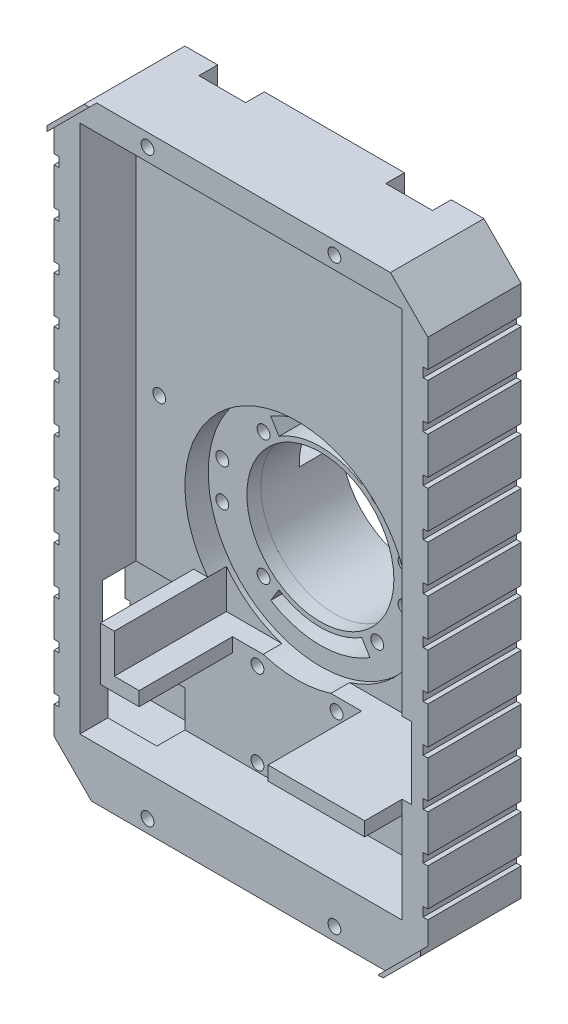
from build123d import *

# Parameters (mm, degrees)
SKETCH1_W               = 101.6
SKETCH1_H               = 165.1
BOSS_EXTRUDE1_DEPTH     = 25.4
SKETCH2_W               = 87.60000006
SKETCH2_H               = 143.87600003
CUT_EXTRUDE1_DEPTH      = 15.24
SKETCH3_R               = 19.9874886
CUT_EXTRUDE2_DEPTH      = 99.119315632
SKETCH4_R               = 26.9875
SKETCH4_R_2             = 19.98750003
BOSS_EXTRUDE2_DEPTH     = 21.844
CUT_EXTRUDE3_DEPTH      = 108.44267553
CUT_EXTRUDE3_DEPTH_BACK = 108.44267553
SKETCH6_R               = 1.750000056
SKETCH7_R               = 1.750000056
CUT_EXTRUDE4_DEPTH      = 108.829207713
SKETCH8_W               = 12.7
SKETCH8_H               = 7.000000224
SKETCH8_H_2             = 6.999986
CUT_EXTRUDE5_DEPTH      = 5.08
SKETCH9_W               = 13.6525
SKETCH9_H               = 25.4
CUT_EXTRUDE6_DEPTH      = 101.201309872
SKETCH10_W              = 11.43
SKETCH10_H              = 11.43
CUT_EXTRUDE7_DEPTH      = 101.201309872
SKETCH11_R              = 30.48
CUT_EXTRUDE8_DEPTH      = 6.35
CUT_EXTRUDE9_REACH      = 109.829
CUT_EXTRUDE10_REACH     = 102.201
SKETCH13_W              = 2.54
SKETCH13_H              = 2.54
CHAMFER9_SIZE           = 10.16
SKETCH14_R              = 1.75
SKETCH14_R_2            = 1.750000056
CUT_EXTRUDE11_DEPTH     = 2.54
SKETCH15_R              = 1.75
CUT_EXTRUDE12_DEPTH     = 5.08
BOSS_EXTRUDE3_DEPTH     = 2
SKETCH18_W              = 13.208
SKETCH18_H              = 18.5
SKETCH18_W_2            = 10.16
SKETCH18_H_2            = 10.16
CUT_EXTRUDE14_DEPTH     = 20.32
SKETCH19_R              = 1.75
CUT_EXTRUDE15_DEPTH     = 5.08
SKETCH20_W              = 6.35
SKETCH20_H              = 13.97
CUT_EXTRUDE16_DEPTH     = 21.59
SKETCH21_W              = 68.072
SKETCH21_H              = 19.558
CUT_EXTRUDE17_DEPTH     = 5.08
SKETCH22_W              = 26.275709958
SKETCH22_H              = 3.81
BOSS_EXTRUDE4_DEPTH     = 25.4
SKETCH23_W              = 20.32
SKETCH23_H              = 19.558
CUT_EXTRUDE18_DEPTH     = 2.54
CUT_EXTRUDE19_DEPTH     = 102.996102867


with BuildPart() as part:
    # Sketch1 → Boss-Extrude1 (new body)
    with BuildSketch(Plane.XY):
        Rectangle(SKETCH1_W, SKETCH1_H)
    extrude(amount=BOSS_EXTRUDE1_DEPTH)

    # Sketch2 → Cut-Extrude1 (cut)
    with BuildSketch(Plane.XY.offset(25.4)):
        with Locations((0, 3.612000015)):
            Rectangle(SKETCH2_W, SKETCH2_H)
    extrude(amount=-CUT_EXTRUDE1_DEPTH, mode=Mode.SUBTRACT)

    # Sketch3 → Cut-Extrude2 (cut, through all)
    with BuildSketch(Plane.XY.offset(10.16)):
        with Locations((0, -10.818398691)):
            Circle(SKETCH3_R)
    extrude(amount=-CUT_EXTRUDE2_DEPTH, mode=Mode.SUBTRACT)

    # Sketch4 → Boss-Extrude2 (add)
    with BuildSketch(Plane(origin=(0, 0, 0), x_dir=(-1, 0, 0), z_dir=(0, 0, -1))):
        with Locations((0, -10.818398691)):
            Circle(SKETCH4_R)
        with Locations(Location((0, -10.818398691, 0), (0, 0, 180))):
            Circle(SKETCH4_R_2, mode=Mode.SUBTRACT)
    extrude(amount=BOSS_EXTRUDE2_DEPTH)

    # Sketch6 → Cut-Extrude3 (cut, two sides: drawn at the far end of the back side and taken through both)
    with BuildSketch(Plane(origin=(0, 0, -20.955), x_dir=(-1, 0, 0), z_dir=(0, 0, -1)).offset(-CUT_EXTRUDE3_DEPTH_BACK)):
        with Locations((15.45282644, 6.199601309)):
            Circle(SKETCH6_R)
        with Locations((15.45282644, -27.836398691)):
            Circle(SKETCH6_R)
        with Locations((-15.45282644, 6.199601309)):
            Circle(SKETCH6_R)
        with Locations((-15.45282644, -27.836398691)):
            Circle(SKETCH6_R)
    extrude(amount=CUT_EXTRUDE3_DEPTH + CUT_EXTRUDE3_DEPTH_BACK, mode=Mode.SUBTRACT)

    # Sketch7 → Cut-Extrude4 (cut, through all)
    with BuildSketch(Plane.XY.offset(25.4)):
        with Locations((-25.4, 79.049999888)):
            Circle(SKETCH7_R)
        with Locations((25.4, -79.049999888)):
            Circle(SKETCH7_R)
        with Locations((-25.4, -79.049999888)):
            Circle(SKETCH7_R)
        with Locations((25.4, 79.049999888)):
            Circle(SKETCH7_R)
    extrude(amount=-CUT_EXTRUDE4_DEPTH, mode=Mode.SUBTRACT)

    # Sketch8 → Cut-Extrude5 (cut)
    with BuildSketch(Plane(origin=(0, 0, 0), x_dir=(-1, 0, 0), z_dir=(0, 0, -1))):
        with Locations((25.4, 79.049999888)):
            Rectangle(SKETCH8_W, SKETCH8_H)
        with Locations((-25.4, 79.050007)):
            Rectangle(SKETCH8_W, SKETCH8_H_2)
        with Locations((25.4, -79.050007)):
            Rectangle(SKETCH8_W, SKETCH8_H_2)
        with Locations((-25.4, -79.049999888)):
            Rectangle(SKETCH8_W, SKETCH8_H)
    extrude(amount=-CUT_EXTRUDE5_DEPTH, mode=Mode.SUBTRACT)

    # Sketch9 → Cut-Extrude6 (cut, through all)
    with BuildSketch(Plane(origin=(0, 0, 0), x_dir=(0, 0, -1), z_dir=(1, 0, 0))):
        with Locations((15.01775, -10.818398691)):
            Rectangle(SKETCH9_W, SKETCH9_H)
    extrude(amount=CUT_EXTRUDE6_DEPTH, mode=Mode.SUBTRACT)

    # Sketch10 → Cut-Extrude7 (cut, through all)
    with BuildSketch(Plane(origin=(0, 0, 0), x_dir=(0, 0, -1), z_dir=(1, 0, 0))):
        with Locations((16.129, -5.738398691)):
            Rectangle(SKETCH10_W, SKETCH10_H)
    extrude(amount=-CUT_EXTRUDE7_DEPTH, mode=Mode.SUBTRACT)

    # Sketch11 → Cut-Extrude8 (cut)
    with BuildSketch(Plane.XY.offset(10.16)):
        with Locations((0, -10.818398691)):
            Circle(SKETCH11_R)
    extrude(amount=-CUT_EXTRUDE8_DEPTH, mode=Mode.SUBTRACT)

    # Sketch12 → Cut-Extrude9 (cut, up to next)
    with BuildSketch(Plane(origin=(0, 0, -21.844), x_dir=(-1, 0, 0), z_dir=(0, 0, -1)), mode=Mode.PRIVATE) as cut_extrude9_sk1:
        with BuildLine():
            Line((-13.4967946, 10.853237604), (-11.250156679, 7.24583886))
            ThreePointArc((-11.250156679, 7.24583886), (-1.4e-08, 10.462642251), (11.250156655, 7.245838875))
            Line((11.250156655, 7.245838875), (13.49679457, 10.853237623))
            ThreePointArc((13.49679457, 10.853237623), (-1.7e-08, 14.712431381), (-13.4967946, 10.853237604))
        make_face()
    cut_extrude9_tool1 = extrude(cut_extrude9_sk1.sketch, amount=-CUT_EXTRUDE9_REACH, mode=Mode.PRIVATE) & part.part
    # Sketch12 → Cut-Extrude9 (cut, up to next)
    with BuildSketch(Plane(origin=(0, 0, -21.844), x_dir=(-1, 0, 0), z_dir=(0, 0, -1)), mode=Mode.PRIVATE) as cut_extrude9_sk2:
        with BuildLine():
            Line((-13.4967946, -32.490034986), (-11.250156679, -28.882636241))
            ThreePointArc((-11.250156679, -28.882636241), (-1.4e-08, -32.099439633), (11.250156655, -28.882636256))
            Line((11.250156655, -28.882636256), (13.49679457, -32.490035004))
            ThreePointArc((13.49679457, -32.490035004), (-1.7e-08, -36.349228763), (-13.4967946, -32.490034986))
        make_face()
    cut_extrude9_tool2 = extrude(cut_extrude9_sk2.sketch, amount=-CUT_EXTRUDE9_REACH, mode=Mode.PRIVATE) & part.part
    add(cut_extrude9_tool1.solids().sort_by_distance((0, 11.4569, -21.844))[0], mode=Mode.SUBTRACT)
    add(cut_extrude9_tool2.solids().sort_by_distance((0, -33.093697, -21.844))[0], mode=Mode.SUBTRACT)

    # Sketch13 → Cut-Extrude10 (cut, up to next)
    with BuildSketch(Plane(origin=(0, 0, 0), x_dir=(-1, 0, 0), z_dir=(0, 0, -1)), mode=Mode.PRIVATE) as cut_extrude10_sk1:
        with Locations((-50.8, -63.5)):
            Rectangle(SKETCH13_W, SKETCH13_H)
    cut_extrude10_tool1 = extrude(cut_extrude10_sk1.sketch, amount=-CUT_EXTRUDE10_REACH, mode=Mode.PRIVATE) & part.part
    # Sketch13 → Cut-Extrude10 (cut, up to next)
    with BuildSketch(Plane(origin=(0, 0, 0), x_dir=(-1, 0, 0), z_dir=(0, 0, -1)), mode=Mode.PRIVATE) as cut_extrude10_sk2:
        with Locations((-50.8, -50.8)):
            Rectangle(SKETCH13_W, SKETCH13_H)
    cut_extrude10_tool2 = extrude(cut_extrude10_sk2.sketch, amount=-CUT_EXTRUDE10_REACH, mode=Mode.PRIVATE) & part.part
    # Sketch13 → Cut-Extrude10 (cut, up to next)
    with BuildSketch(Plane(origin=(0, 0, 0), x_dir=(-1, 0, 0), z_dir=(0, 0, -1)), mode=Mode.PRIVATE) as cut_extrude10_sk3:
        with Locations((-50.8, -38.1)):
            Rectangle(SKETCH13_W, SKETCH13_H)
    cut_extrude10_tool3 = extrude(cut_extrude10_sk3.sketch, amount=-CUT_EXTRUDE10_REACH, mode=Mode.PRIVATE) & part.part
    # Sketch13 → Cut-Extrude10 (cut, up to next)
    with BuildSketch(Plane(origin=(0, 0, 0), x_dir=(-1, 0, 0), z_dir=(0, 0, -1)), mode=Mode.PRIVATE) as cut_extrude10_sk4:
        with Locations((-50.8, -25.4)):
            Rectangle(SKETCH13_W, SKETCH13_H)
    cut_extrude10_tool4 = extrude(cut_extrude10_sk4.sketch, amount=-CUT_EXTRUDE10_REACH, mode=Mode.PRIVATE) & part.part
    # Sketch13 → Cut-Extrude10 (cut, up to next)
    with BuildSketch(Plane(origin=(0, 0, 0), x_dir=(-1, 0, 0), z_dir=(0, 0, -1)), mode=Mode.PRIVATE) as cut_extrude10_sk5:
        with Locations((-50.8, -12.7)):
            Rectangle(SKETCH13_W, SKETCH13_H)
    cut_extrude10_tool5 = extrude(cut_extrude10_sk5.sketch, amount=-CUT_EXTRUDE10_REACH, mode=Mode.PRIVATE) & part.part
    # Sketch13 → Cut-Extrude10 (cut, up to next)
    with BuildSketch(Plane(origin=(0, 0, 0), x_dir=(-1, 0, 0), z_dir=(0, 0, -1)), mode=Mode.PRIVATE) as cut_extrude10_sk6:
        with Locations((-50.8, 0)):
            Rectangle(SKETCH13_W, SKETCH13_H)
    cut_extrude10_tool6 = extrude(cut_extrude10_sk6.sketch, amount=-CUT_EXTRUDE10_REACH, mode=Mode.PRIVATE) & part.part
    # Sketch13 → Cut-Extrude10 (cut, up to next)
    with BuildSketch(Plane(origin=(0, 0, 0), x_dir=(-1, 0, 0), z_dir=(0, 0, -1)), mode=Mode.PRIVATE) as cut_extrude10_sk7:
        with Locations((-50.8, 12.7)):
            Rectangle(SKETCH13_W, SKETCH13_H)
    cut_extrude10_tool7 = extrude(cut_extrude10_sk7.sketch, amount=-CUT_EXTRUDE10_REACH, mode=Mode.PRIVATE) & part.part
    # Sketch13 → Cut-Extrude10 (cut, up to next)
    with BuildSketch(Plane(origin=(0, 0, 0), x_dir=(-1, 0, 0), z_dir=(0, 0, -1)), mode=Mode.PRIVATE) as cut_extrude10_sk8:
        with Locations((-50.8, 25.4)):
            Rectangle(SKETCH13_W, SKETCH13_H)
    cut_extrude10_tool8 = extrude(cut_extrude10_sk8.sketch, amount=-CUT_EXTRUDE10_REACH, mode=Mode.PRIVATE) & part.part
    # Sketch13 → Cut-Extrude10 (cut, up to next)
    with BuildSketch(Plane(origin=(0, 0, 0), x_dir=(-1, 0, 0), z_dir=(0, 0, -1)), mode=Mode.PRIVATE) as cut_extrude10_sk9:
        with Locations((-50.8, 38.1)):
            Rectangle(SKETCH13_W, SKETCH13_H)
    cut_extrude10_tool9 = extrude(cut_extrude10_sk9.sketch, amount=-CUT_EXTRUDE10_REACH, mode=Mode.PRIVATE) & part.part
    # Sketch13 → Cut-Extrude10 (cut, up to next)
    with BuildSketch(Plane(origin=(0, 0, 0), x_dir=(-1, 0, 0), z_dir=(0, 0, -1)), mode=Mode.PRIVATE) as cut_extrude10_sk10:
        with Locations((-50.8, 50.8)):
            Rectangle(SKETCH13_W, SKETCH13_H)
    cut_extrude10_tool10 = extrude(cut_extrude10_sk10.sketch, amount=-CUT_EXTRUDE10_REACH, mode=Mode.PRIVATE) & part.part
    # Sketch13 → Cut-Extrude10 (cut, up to next)
    with BuildSketch(Plane(origin=(0, 0, 0), x_dir=(-1, 0, 0), z_dir=(0, 0, -1)), mode=Mode.PRIVATE) as cut_extrude10_sk11:
        with Locations((-50.8, 63.5)):
            Rectangle(SKETCH13_W, SKETCH13_H)
    cut_extrude10_tool11 = extrude(cut_extrude10_sk11.sketch, amount=-CUT_EXTRUDE10_REACH, mode=Mode.PRIVATE) & part.part
    # Sketch13 → Cut-Extrude10 (cut, up to next)
    with BuildSketch(Plane(origin=(0, 0, 0), x_dir=(-1, 0, 0), z_dir=(0, 0, -1)), mode=Mode.PRIVATE) as cut_extrude10_sk12:
        with Locations((50.8, -63.5)):
            Rectangle(SKETCH13_W, SKETCH13_H)
    cut_extrude10_tool12 = extrude(cut_extrude10_sk12.sketch, amount=-CUT_EXTRUDE10_REACH, mode=Mode.PRIVATE) & part.part
    # Sketch13 → Cut-Extrude10 (cut, up to next)
    with BuildSketch(Plane(origin=(0, 0, 0), x_dir=(-1, 0, 0), z_dir=(0, 0, -1)), mode=Mode.PRIVATE) as cut_extrude10_sk13:
        with Locations((50.8, -50.8)):
            Rectangle(SKETCH13_W, SKETCH13_H)
    cut_extrude10_tool13 = extrude(cut_extrude10_sk13.sketch, amount=-CUT_EXTRUDE10_REACH, mode=Mode.PRIVATE) & part.part
    # Sketch13 → Cut-Extrude10 (cut, up to next)
    with BuildSketch(Plane(origin=(0, 0, 0), x_dir=(-1, 0, 0), z_dir=(0, 0, -1)), mode=Mode.PRIVATE) as cut_extrude10_sk14:
        with Locations((50.8, -38.1)):
            Rectangle(SKETCH13_W, SKETCH13_H)
    cut_extrude10_tool14 = extrude(cut_extrude10_sk14.sketch, amount=-CUT_EXTRUDE10_REACH, mode=Mode.PRIVATE) & part.part
    # Sketch13 → Cut-Extrude10 (cut, up to next)
    with BuildSketch(Plane(origin=(0, 0, 0), x_dir=(-1, 0, 0), z_dir=(0, 0, -1)), mode=Mode.PRIVATE) as cut_extrude10_sk15:
        with Locations((50.8, -25.4)):
            Rectangle(SKETCH13_W, SKETCH13_H)
    cut_extrude10_tool15 = extrude(cut_extrude10_sk15.sketch, amount=-CUT_EXTRUDE10_REACH, mode=Mode.PRIVATE) & part.part
    # Sketch13 → Cut-Extrude10 (cut, up to next)
    with BuildSketch(Plane(origin=(0, 0, 0), x_dir=(-1, 0, 0), z_dir=(0, 0, -1)), mode=Mode.PRIVATE) as cut_extrude10_sk16:
        with Locations((50.8, -12.7)):
            Rectangle(SKETCH13_W, SKETCH13_H)
    cut_extrude10_tool16 = extrude(cut_extrude10_sk16.sketch, amount=-CUT_EXTRUDE10_REACH, mode=Mode.PRIVATE) & part.part
    # Sketch13 → Cut-Extrude10 (cut, up to next)
    with BuildSketch(Plane(origin=(0, 0, 0), x_dir=(-1, 0, 0), z_dir=(0, 0, -1)), mode=Mode.PRIVATE) as cut_extrude10_sk17:
        with Locations((50.8, 0)):
            Rectangle(SKETCH13_W, SKETCH13_H)
    cut_extrude10_tool17 = extrude(cut_extrude10_sk17.sketch, amount=-CUT_EXTRUDE10_REACH, mode=Mode.PRIVATE) & part.part
    # Sketch13 → Cut-Extrude10 (cut, up to next)
    with BuildSketch(Plane(origin=(0, 0, 0), x_dir=(-1, 0, 0), z_dir=(0, 0, -1)), mode=Mode.PRIVATE) as cut_extrude10_sk18:
        with Locations((50.8, 12.7)):
            Rectangle(SKETCH13_W, SKETCH13_H)
    cut_extrude10_tool18 = extrude(cut_extrude10_sk18.sketch, amount=-CUT_EXTRUDE10_REACH, mode=Mode.PRIVATE) & part.part
    # Sketch13 → Cut-Extrude10 (cut, up to next)
    with BuildSketch(Plane(origin=(0, 0, 0), x_dir=(-1, 0, 0), z_dir=(0, 0, -1)), mode=Mode.PRIVATE) as cut_extrude10_sk19:
        with Locations((50.8, 25.4)):
            Rectangle(SKETCH13_W, SKETCH13_H)
    cut_extrude10_tool19 = extrude(cut_extrude10_sk19.sketch, amount=-CUT_EXTRUDE10_REACH, mode=Mode.PRIVATE) & part.part
    # Sketch13 → Cut-Extrude10 (cut, up to next)
    with BuildSketch(Plane(origin=(0, 0, 0), x_dir=(-1, 0, 0), z_dir=(0, 0, -1)), mode=Mode.PRIVATE) as cut_extrude10_sk20:
        with Locations((50.8, 38.1)):
            Rectangle(SKETCH13_W, SKETCH13_H)
    cut_extrude10_tool20 = extrude(cut_extrude10_sk20.sketch, amount=-CUT_EXTRUDE10_REACH, mode=Mode.PRIVATE) & part.part
    # Sketch13 → Cut-Extrude10 (cut, up to next)
    with BuildSketch(Plane(origin=(0, 0, 0), x_dir=(-1, 0, 0), z_dir=(0, 0, -1)), mode=Mode.PRIVATE) as cut_extrude10_sk21:
        with Locations((50.8, 50.8)):
            Rectangle(SKETCH13_W, SKETCH13_H)
    cut_extrude10_tool21 = extrude(cut_extrude10_sk21.sketch, amount=-CUT_EXTRUDE10_REACH, mode=Mode.PRIVATE) & part.part
    # Sketch13 → Cut-Extrude10 (cut, up to next)
    with BuildSketch(Plane(origin=(0, 0, 0), x_dir=(-1, 0, 0), z_dir=(0, 0, -1)), mode=Mode.PRIVATE) as cut_extrude10_sk22:
        with Locations((50.8, 63.5)):
            Rectangle(SKETCH13_W, SKETCH13_H)
    cut_extrude10_tool22 = extrude(cut_extrude10_sk22.sketch, amount=-CUT_EXTRUDE10_REACH, mode=Mode.PRIVATE) & part.part
    add(cut_extrude10_tool1.solids().sort_by_distance((50.8, -63.5, 0))[0], mode=Mode.SUBTRACT)
    add(cut_extrude10_tool2.solids().sort_by_distance((50.8, -50.8, 0))[0], mode=Mode.SUBTRACT)
    add(cut_extrude10_tool3.solids().sort_by_distance((50.8, -38.1, 0))[0], mode=Mode.SUBTRACT)
    add(cut_extrude10_tool4.solids().sort_by_distance((50.8, -25.4, 0))[0], mode=Mode.SUBTRACT)
    add(cut_extrude10_tool5.solids().sort_by_distance((50.8, -12.7, 0))[0], mode=Mode.SUBTRACT)
    add(cut_extrude10_tool6.solids().sort_by_distance((50.8, 0, 0))[0], mode=Mode.SUBTRACT)
    add(cut_extrude10_tool7.solids().sort_by_distance((50.8, 12.7, 0))[0], mode=Mode.SUBTRACT)
    add(cut_extrude10_tool8.solids().sort_by_distance((50.8, 25.4, 0))[0], mode=Mode.SUBTRACT)
    add(cut_extrude10_tool9.solids().sort_by_distance((50.8, 38.1, 0))[0], mode=Mode.SUBTRACT)
    add(cut_extrude10_tool10.solids().sort_by_distance((50.8, 50.8, 0))[0], mode=Mode.SUBTRACT)
    add(cut_extrude10_tool11.solids().sort_by_distance((50.8, 63.5, 0))[0], mode=Mode.SUBTRACT)
    add(cut_extrude10_tool12.solids().sort_by_distance((-50.8, -63.5, 0))[0], mode=Mode.SUBTRACT)
    add(cut_extrude10_tool13.solids().sort_by_distance((-50.8, -50.8, 0))[0], mode=Mode.SUBTRACT)
    add(cut_extrude10_tool14.solids().sort_by_distance((-50.8, -38.1, 0))[0], mode=Mode.SUBTRACT)
    add(cut_extrude10_tool15.solids().sort_by_distance((-50.8, -25.4, 0))[0], mode=Mode.SUBTRACT)
    add(cut_extrude10_tool16.solids().sort_by_distance((-50.8, -12.7, 0))[0], mode=Mode.SUBTRACT)
    add(cut_extrude10_tool17.solids().sort_by_distance((-50.8, 0, 0))[0], mode=Mode.SUBTRACT)
    add(cut_extrude10_tool18.solids().sort_by_distance((-50.8, 12.7, 0))[0], mode=Mode.SUBTRACT)
    add(cut_extrude10_tool19.solids().sort_by_distance((-50.8, 25.4, 0))[0], mode=Mode.SUBTRACT)
    add(cut_extrude10_tool20.solids().sort_by_distance((-50.8, 38.1, 0))[0], mode=Mode.SUBTRACT)
    add(cut_extrude10_tool21.solids().sort_by_distance((-50.8, 50.8, 0))[0], mode=Mode.SUBTRACT)
    add(cut_extrude10_tool22.solids().sort_by_distance((-50.8, 63.5, 0))[0], mode=Mode.SUBTRACT)

    # Chamfer9
    chamfer9_edges = [part.edges().sort_by_distance(p)[0] for p in [
        (50.8, -82.55, 12.7),
        (-50.8, -82.55, 12.7),
        (-50.8, 82.55, 12.7),
        (50.8, 82.55, 12.7),
    ]]
    chamfer(chamfer9_edges, length=CHAMFER9_SIZE)

    # Sketch14 → Cut-Extrude11 (cut)
    with BuildSketch(Plane.XY.offset(3.81)):
        with Locations((-26.67, -5.738398691)):
            Circle(SKETCH14_R)
        with Locations((-26.67, -15.898398691)):
            Circle(SKETCH14_R)
        with Locations((22.86, -5.738398691)):
            Circle(SKETCH14_R)
        with Locations((22.86, -15.898398691)):
            Circle(SKETCH14_R_2)
    extrude(amount=-CUT_EXTRUDE11_DEPTH, mode=Mode.SUBTRACT)

    # Sketch15 → Cut-Extrude12 (cut)
    with BuildSketch(Plane.XY.offset(10.16)):
        with Locations((-37.45000003, 69.20000003)):
            Circle(SKETCH15_R)
        with Locations((-37.45000003, 6.921583589)):
            Circle(SKETCH15_R)
        with Locations((38.08500003, 69.20000003)):
            Circle(SKETCH15_R)
        with Locations((38.08500003, 6.921583533)):
            Circle(SKETCH15_R)
    extrude(amount=-CUT_EXTRUDE12_DEPTH, mode=Mode.SUBTRACT)

    # Sketch16 → Boss-Extrude3 (add)
    with BuildSketch(Plane.XY.offset(25.4)):
        Polygon((-45.012893219, 76.762893219), (-50.8, 70.975786438), (-50.8, 72.39), (-40.64, 82.55), (-39.225786438, 82.55), align=None)
        Polygon((45.012893219, -76.762893219), (39.225786438, -82.55), (40.64, -82.55), (50.8, -72.39), (50.8, -70.975786438), align=None)
    extrude(amount=BOSS_EXTRUDE3_DEPTH)

    # Sketch18 → Cut-Extrude14 (cut)
    with BuildSketch(Plane.ZY.offset(50.8)):
        with Locations((12.7, -44.45)):
            Rectangle(SKETCH18_W, SKETCH18_H)
        with Locations((12.7, -63.5)):
            Rectangle(SKETCH18_W_2, SKETCH18_H_2)
    extrude(amount=-CUT_EXTRUDE14_DEPTH, mode=Mode.SUBTRACT)

    # Sketch19 → Cut-Extrude15 (cut)
    with BuildSketch(Plane.XY.offset(10.16)):
        with Locations((-10.759499944, -43.417699345)):
            Circle(SKETCH19_R)
        with Locations((10.759499944, -43.417699345)):
            Circle(SKETCH19_R)
        with Locations((10.1245, -66.206699345)):
            Circle(SKETCH19_R)
        with Locations((-10.759499944, -66.206699345)):
            Circle(SKETCH19_R)
    extrude(amount=-CUT_EXTRUDE15_DEPTH, mode=Mode.SUBTRACT)

    # Sketch20 → Cut-Extrude16 (cut)
    with BuildSketch(Plane(origin=(0, 0, 0), x_dir=(0, 0, -1), z_dir=(1, 0, 0))):
        with Locations((3.175, -10.314800064)):
            Rectangle(SKETCH20_W, SKETCH20_H)
    extrude(amount=CUT_EXTRUDE16_DEPTH, mode=Mode.SUBTRACT)

    # Sketch21 → Cut-Extrude17 (cut)
    with BuildSketch(Plane.XY.offset(10.16)):
        with Locations((9.76400003, -30.099)):
            Rectangle(SKETCH21_W, SKETCH21_H)
    extrude(amount=-CUT_EXTRUDE17_DEPTH, mode=Mode.SUBTRACT)

    # Sketch22 → Boss-Extrude4 (add)
    with BuildSketch(Plane.XY.offset(10.16)):
        Polygon((-24.27199997, -29.254787097), (-28.08199997, -29.254787097), (-28.08199997, -43.688), (-17.524290109, -43.688), (-17.524290109, -39.878), (-24.27199997, -39.878), align=None)
        with Locations((30.662145051, -41.783)):
            Rectangle(SKETCH22_W, SKETCH22_H)
    extrude(amount=BOSS_EXTRUDE4_DEPTH)

    # Sketch23 → Cut-Extrude18 (cut)
    with BuildSketch(Plane.ZY.offset(-43.80000003)):
        with Locations((15.24, -30.099)):
            Rectangle(SKETCH23_W, SKETCH23_H)
    extrude(amount=-CUT_EXTRUDE18_DEPTH, mode=Mode.SUBTRACT)

    # Sketch24 → Cut-Extrude19 (cut, through all)
    with BuildSketch(Plane.XY.offset(3.81)):
        with BuildLine():
            Line((18.452826536, 1.881601309), (23.8125, 1.881601309))
            ThreePointArc((23.8125, 1.881601309), (22.007461556, 4.801997979), (19.846264441, 7.469601309))
            Line((19.846264441, 7.469601309), (18.452826536, 7.469601309))
            Line((18.452826536, 7.469601309), (18.452826536, 1.881601309))
        make_face()
    extrude(amount=-CUT_EXTRUDE19_DEPTH, mode=Mode.SUBTRACT)


solid = part.part
